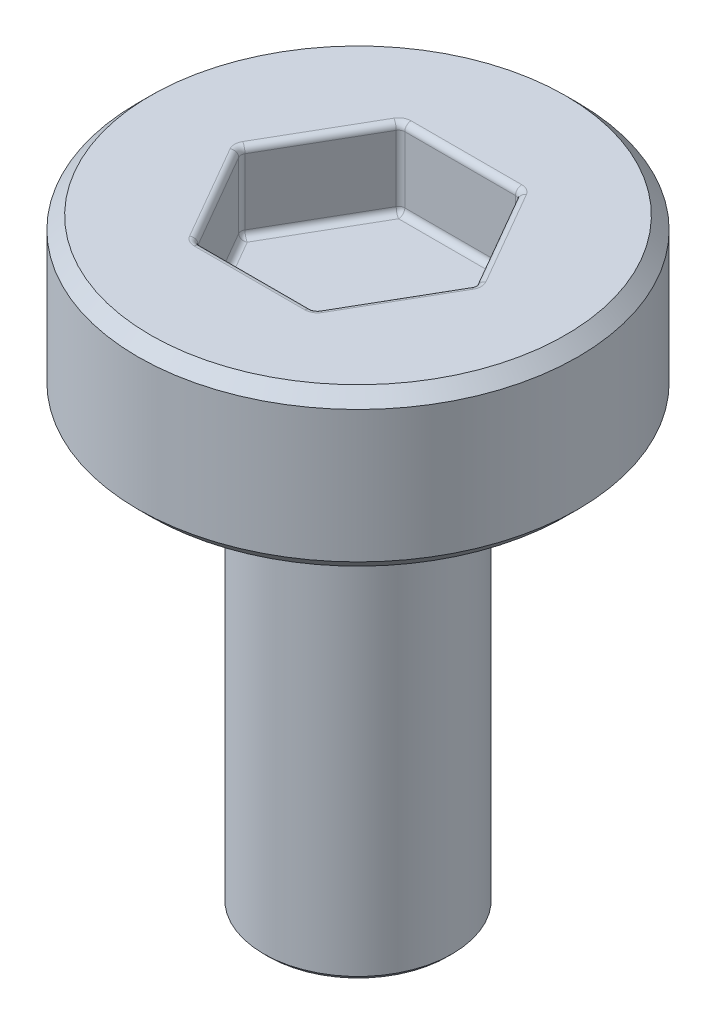
from build123d import *

# Parameters (mm, degrees)
SKETCH1_R           = 1.5
BOSS_EXTRUDE1_DEPTH = 7
SKETCH2_R           = 3.5
BOSS_EXTRUDE2_DEPTH = 2.5
FILLET1_R           = 0.15
CHAMFER1_SIZE       = 0.2
CUT_EXTRUDE1_DEPTH  = 1.25
CHAMFER2_SIZE       = 0.075
FILLET2_R           = 0.1


with BuildPart() as part:
    # Sketch1 → Boss-Extrude1 (new body)
    with BuildSketch(Plane(origin=(0, 0, 0), x_dir=(1, 0, 0), z_dir=(0, 1, 0))):
        with Locations(Location((0, 0, 0), (0, 0, 270))):
            Circle(SKETCH1_R)
    extrude(amount=BOSS_EXTRUDE1_DEPTH)

    # Sketch2 → Boss-Extrude2 (add)
    with BuildSketch(Plane(origin=(0, 7, 0), x_dir=(1, 0, 0), z_dir=(0, 1, 0))):
        with Locations(Location((0, 0, 0), (0, 0, 270))):
            Circle(SKETCH2_R)
    extrude(amount=BOSS_EXTRUDE2_DEPTH)

    # Fillet1
    fillet1_edges = [part.edges().sort_by_distance(p)[0] for p in [
        (0, 7, -1.5),
    ]]
    fillet(fillet1_edges, radius=FILLET1_R)

    # Chamfer1
    chamfer1_edges = [part.edges().sort_by_distance(p)[0] for p in [
        (0, 7, -3.5),
        (0, 9.5, -3.5),
    ]]
    chamfer(chamfer1_edges, length=CHAMFER1_SIZE)

    # Sketch5 → Cut-Extrude1 (cut)
    with BuildSketch(Plane(origin=(0, 9.5, 0), x_dir=(1, 0, 0), z_dir=(0, 1, 0))):
        Polygon((0.938194187, 1.625), (-0.938194187, 1.625), (-1.876388375, 0), (-0.938194187, -1.625), (0.938194187, -1.625), (1.876388375, 0), align=None)
    extrude(amount=-CUT_EXTRUDE1_DEPTH, mode=Mode.SUBTRACT)

    # Chamfer2
    chamfer2_edges = [part.edges().sort_by_distance(p)[0] for p in [
        (0, 0, -1.5),
    ]]
    chamfer(chamfer2_edges, length=CHAMFER2_SIZE)

    # Fillet2
    fillet2_edges = [part.edges().sort_by_distance(p)[0] for p in [
        (1.407291281, 8.25, -0.8125),
        (0.938194187, 8.875, -1.625),
        (1.407291281, 8.25, 0.8125),
        (1.876388375, 8.875, 0),
        (0, 8.25, 1.625),
        (0.938194187, 8.875, 1.625),
        (-1.407291281, 8.25, 0.8125),
        (-0.938194187, 8.875, 1.625),
        (-1.407291281, 8.25, -0.8125),
        (-1.876388375, 8.875, 0),
        (0, 8.25, -1.625),
        (-0.938194187, 8.875, -1.625),
        (1.407291281, 9.5, -0.8125),
        (0, 9.5, -1.625),
        (-1.407291281, 9.5, -0.8125),
        (-1.407291281, 9.5, 0.8125),
        (0, 9.5, 1.625),
        (1.407291281, 9.5, 0.8125),
    ]]
    fillet(fillet2_edges, radius=FILLET2_R)


solid = part.part
